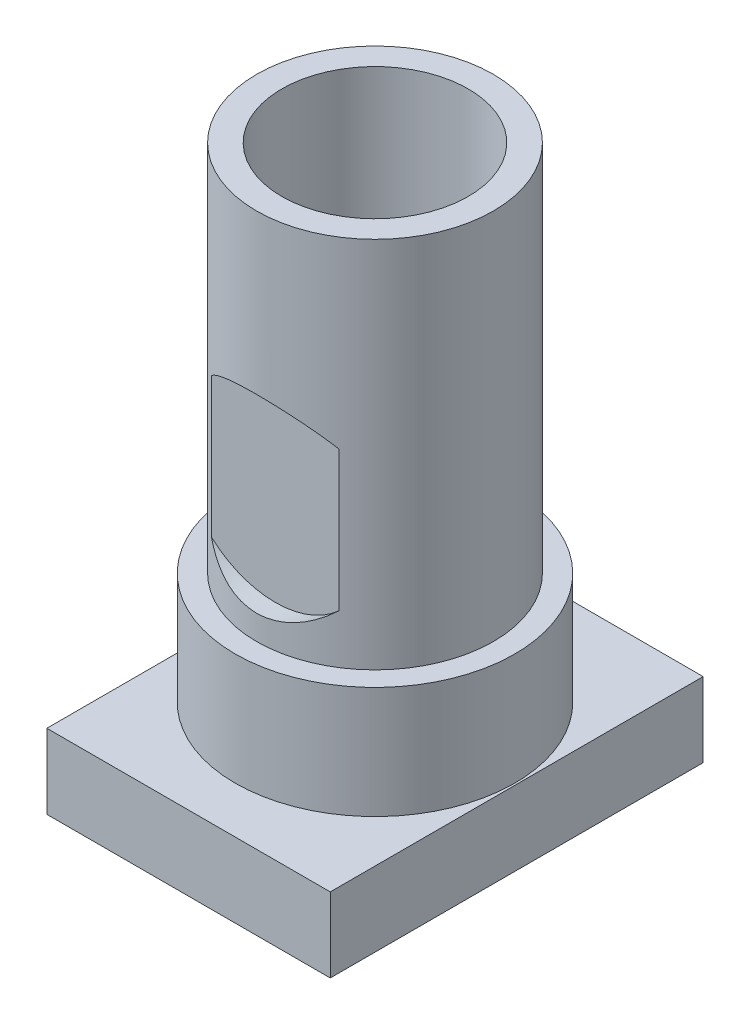
from build123d import *

# Parameters (mm, degrees)
ESQUISSE1_W             = 7.6
ESQUISSE1_H             = 10
BOSS_EXTRU_1_DEPTH      = 2
ESQUISSE2_R             = 3.75
ESQUISSE2_R_2           = 2.5
BOSS_EXTRU_2_DEPTH      = 3
ESQUISSE3_R             = 3.175
ESQUISSE3_R_2           = 2.5
BOSS_EXTRU_3_DEPTH      = 10
ESQUISSE4_R             = 1.325
ENL_V_MAT_EXTRU_1_DEPTH = 15.437451299
ESQUISSE6_R             = 2.54
ENL_V_MAT_EXTRU_3_DEPTH = 0.5


with BuildPart() as part:
    # Esquisse1 → Boss.-Extru.1 (new body)
    with BuildSketch(Plane(origin=(0, 0, 0), x_dir=(1, 0, 0), z_dir=(0, 1, 0))):
        Rectangle(ESQUISSE1_W, ESQUISSE1_H)
    extrude(amount=BOSS_EXTRU_1_DEPTH)

    # Esquisse2 → Boss.-Extru.2 (add)
    with BuildSketch(Plane(origin=(0, 2, 0), x_dir=(1, 0, 0), z_dir=(0, 1, 0))):
        with Locations(Location((0, 0, 0), (0, 0, 270))):
            Circle(ESQUISSE2_R)
        with Locations(Location((0, 0, 0), (0, 0, 270))):
            Circle(ESQUISSE2_R_2, mode=Mode.SUBTRACT)
    extrude(amount=BOSS_EXTRU_2_DEPTH)

    # Esquisse3 → Boss.-Extru.3 (add)
    with BuildSketch(Plane(origin=(0, 5, 0), x_dir=(1, 0, 0), z_dir=(0, 1, 0))):
        with Locations(Location((0, 0, 0), (0, 0, 270))):
            Circle(ESQUISSE3_R)
        with Locations(Location((0, 0, 0), (0, 0, 270))):
            Circle(ESQUISSE3_R_2, mode=Mode.SUBTRACT)
    extrude(amount=BOSS_EXTRU_3_DEPTH)

    # Esquisse4 → Enlèv. mat.-Extru.1 (cut, through all)
    with BuildSketch(Plane(origin=(0, 2, 0), x_dir=(1, 0, 0), z_dir=(0, 1, 0))):
        with Locations(Location((0, 0, 0), (0, 0, 270))):
            Circle(ESQUISSE4_R)
    extrude(amount=-ENL_V_MAT_EXTRU_1_DEPTH, mode=Mode.SUBTRACT)

    # Esquisse6 → Enlèv. mat.-Extru.3 (cut)
    with BuildSketch(Plane.XY.offset(3.175)):
        with Locations((0, 8.2)):
            Circle(ESQUISSE6_R)
    extrude(amount=-ENL_V_MAT_EXTRU_3_DEPTH, mode=Mode.SUBTRACT)


solid = part.part
